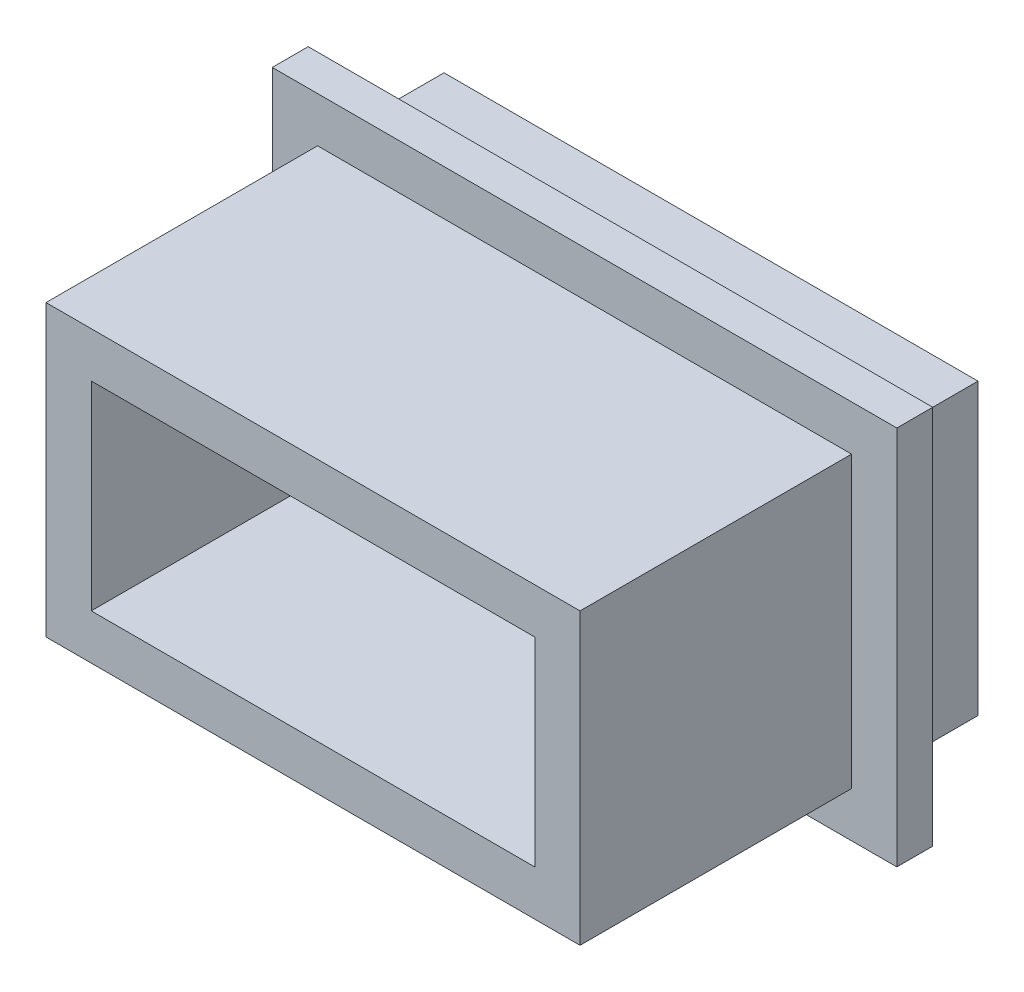
from build123d import *

# Parameters (mm, degrees)
SKETCH1_W           = 5.9
SKETCH1_H           = 3.2
SKETCH1_W_2         = 4.9
SKETCH1_H_2         = 2.2
BOSS_EXTRUDE1_DEPTH = 1
SKETCH2_W           = 6.9
SKETCH2_H           = 4.2
SKETCH2_W_2         = 4.9
SKETCH2_H_2         = 2.2
BOSS_EXTRUDE2_DEPTH = 0.396875
SKETCH3_W           = 5.9
SKETCH3_H           = 3.2
SKETCH3_W_2         = 4.9
SKETCH3_H_2         = 2.2
BOSS_EXTRUDE3_DEPTH = 3


with BuildPart() as part:
    # Sketch1 → Boss-Extrude1 (new body)
    with BuildSketch(Plane.XY):
        with Locations((0, 5.4)):
            Rectangle(SKETCH1_W, SKETCH1_H)
        with Locations((0, 5.4)):
            Rectangle(SKETCH1_W_2, SKETCH1_H_2, mode=Mode.SUBTRACT)
    extrude(amount=BOSS_EXTRUDE1_DEPTH)

    # Sketch2 → Boss-Extrude2 (add)
    with BuildSketch(Plane.XY.offset(1)):
        with Locations((0, 5.4)):
            Rectangle(SKETCH2_W, SKETCH2_H)
        with Locations((0, 5.4)):
            Rectangle(SKETCH2_W_2, SKETCH2_H_2, mode=Mode.SUBTRACT)
    extrude(amount=BOSS_EXTRUDE2_DEPTH)

    # Sketch3 → Boss-Extrude3 (add)
    with BuildSketch(Plane.XY.offset(1.396875)):
        with Locations((0, 5.4)):
            Rectangle(SKETCH3_W, SKETCH3_H)
        with Locations((0, 5.4)):
            Rectangle(SKETCH3_W_2, SKETCH3_H_2, mode=Mode.SUBTRACT)
    extrude(amount=BOSS_EXTRUDE3_DEPTH)


solid = part.part
